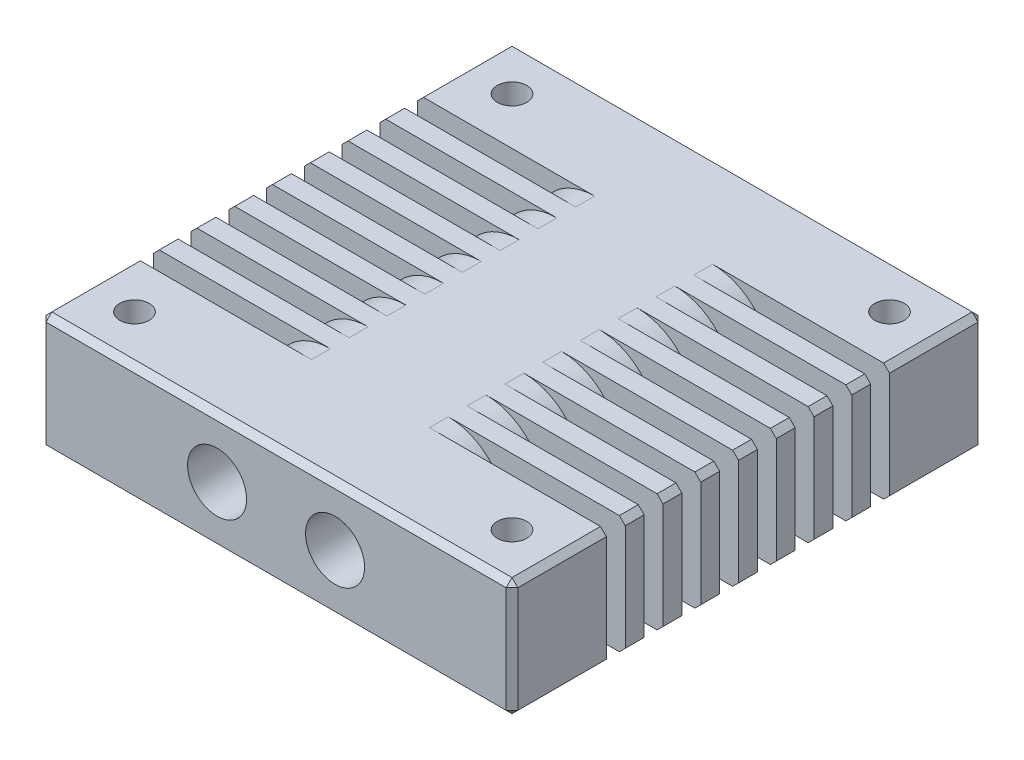
from build123d import *

# Parameters (mm, degrees)
ESQUISSE2_W                               = 40
ESQUISSE2_H                               = 10
BOSS_EXTRU_1_DEPTH                        = 40
DIAM_TRE_DU_PER_AGE_4_1_4_1_1_D           = 4.1
TROU_POUR_TARAUDAGE_POUR_TROU_TARAUD_M3_D = 2.5
CHANFREIN1_SIZE                           = 0.5
R_P_TITION_LIN_AIRE2_COUNT                = 2
R_P_TITION_LIN_AIRE2_PITCH                = 10
ENL_V_START                               = 8
ESQUISSE20_R                              = 30.056093749
ENL_V_MAT_EXTRU_1_DEPTH                   = 1.6
R_P_TITION_LIN_AIRE1_COUNT                = 8
R_P_TITION_LIN_AIRE1_PITCH                = 3.2


with BuildPart() as part:
    # Esquisse2 → Boss.-Extru.1 (new body)
    with BuildSketch(Plane.XY):
        with Locations((20, 5)):
            Rectangle(ESQUISSE2_W, ESQUISSE2_H)
    extrude(amount=BOSS_EXTRU_1_DEPTH)

    # Diamètre du perçage Ø4.1 (4.1)1 (through all)
    with Locations(Plane.XY.offset(40)):
        with Locations((25, 5)):
            diam_tre_du_per_age_4_1_4_1_1 = Hole(DIAM_TRE_DU_PER_AGE_4_1_4_1_1_D / 2)

    # Esquisse9 → Trou pour taraudage pour trou taraudé M61 (revolve, cut)
    with BuildSketch(Plane(origin=(25, 5, 40), x_dir=(0, -1, 0), z_dir=(1, 0, 0))):
        Polygon((0, 0), (0, 9.502151548), (2.5, 8), (2.5, 0), align=None)
    trou_pour_taraudage_pour_trou_taraud_m6 = revolve(axis=Axis((25, 5, 46.35), (0, 0, -1)), mode=Mode.SUBTRACT)

    # Esquisse13 → Diamètre du perçage Ø6.0 (6)1 (revolve, cut)
    with BuildSketch(Plane(origin=(25, 5, 0), x_dir=(0, 1, 0), z_dir=(1, 0, 0))):
        Polygon((0, 0), (0, 21.802581857), (3, 20), (3, 0), align=None)
    diam_tre_du_per_age_6_0_6_1 = revolve(axis=Axis((25, 5, -6.35), (0, 0, 1)), mode=Mode.SUBTRACT)

    # Trou pour taraudage pour trou taraud_ M3 (through all)
    with Locations(Plane(origin=(0, 0, 0), x_dir=(-1, 0, 0), z_dir=(0, -1, 0))):
        with Locations((-4, -36), (-36, -36), (-36, -4), (-4, -4)):
            Hole(TROU_POUR_TARAUDAGE_POUR_TROU_TARAUD_M3_D / 2)

    # Esquisse18 → Trou pour taraudage pour trou taraud 2 (revolve, cut)
    with BuildSketch(Plane(origin=(25, 0, 4), x_dir=(0, 0, -1), z_dir=(1, 0, 0))):
        Polygon((0, 0), (0, 5.751075774), (1.25, 5), (1.25, 0), align=None)
    trou_pour_taraudage_pour_trou_taraud_2 = revolve(axis=Axis((25, -6.35, 4), (0, 1, 0)), mode=Mode.SUBTRACT)

    # Chanfrein1
    chanfrein1_edges = [part.edges().sort_by_distance(p)[0] for p in [
        (40, 5, 40),
        (20, 10, 40),
        (0, 5, 40),
        (20, 10, 0),
        (40, 5, 0),
        (20, 0, 0),
        (0, 5, 0),
        (20, 0, 40),
        (0, 10, 20),
        (40, 10, 20),
        (40, 0, 20),
        (0, 0, 20),
    ]]
    chamfer(chanfrein1_edges, length=CHANFREIN1_SIZE)

    # Répétition linéaire2: Diamètre du perçage Ø4.1 (4.1)1, Trou pour taraudage pour trou taraudé M61, Diamètre du perçage Ø6.0 (6)1, Trou pour taraudage pour trou taraud 2 ×2
    with Locations(*[(-i * R_P_TITION_LIN_AIRE2_PITCH, 0, 0) for i in range(1, R_P_TITION_LIN_AIRE2_COUNT)]):
        add(diam_tre_du_per_age_4_1_4_1_1, mode=Mode.SUBTRACT)
        add(trou_pour_taraudage_pour_trou_taraud_m6, mode=Mode.SUBTRACT)
        add(diam_tre_du_per_age_6_0_6_1, mode=Mode.SUBTRACT)
        add(trou_pour_taraudage_pour_trou_taraud_2, mode=Mode.SUBTRACT)

    # Esquisse20 → Enlèv. mat.-Extru.1 (cut)
    with BuildSketch(Plane(origin=(0, 40, 40), x_dir=(-1, 0, 0), z_dir=(0, 0, -1)).offset(ENL_V_START)):
        with Locations((-20, -35)):
            Circle(ESQUISSE20_R)
        with BuildLine():
            Line((-15, -40), (-25, -40))
            ThreePointArc((-25, -40), (-30, -35), (-25, -30))
            Line((-25, -30), (-15, -30))
            ThreePointArc((-15, -30), (-10, -35), (-15, -40))
        make_face(mode=Mode.SUBTRACT)
    enl_v_mat_extru_1 = extrude(amount=ENL_V_MAT_EXTRU_1_DEPTH, mode=Mode.SUBTRACT)

    # Répétition linéaire1: Enlèv. mat.-Extru.1 ×8
    with Locations(*[(0, 0, -i * R_P_TITION_LIN_AIRE1_PITCH) for i in range(1, R_P_TITION_LIN_AIRE1_COUNT)]):
        add(enl_v_mat_extru_1, mode=Mode.SUBTRACT)


solid = part.part
